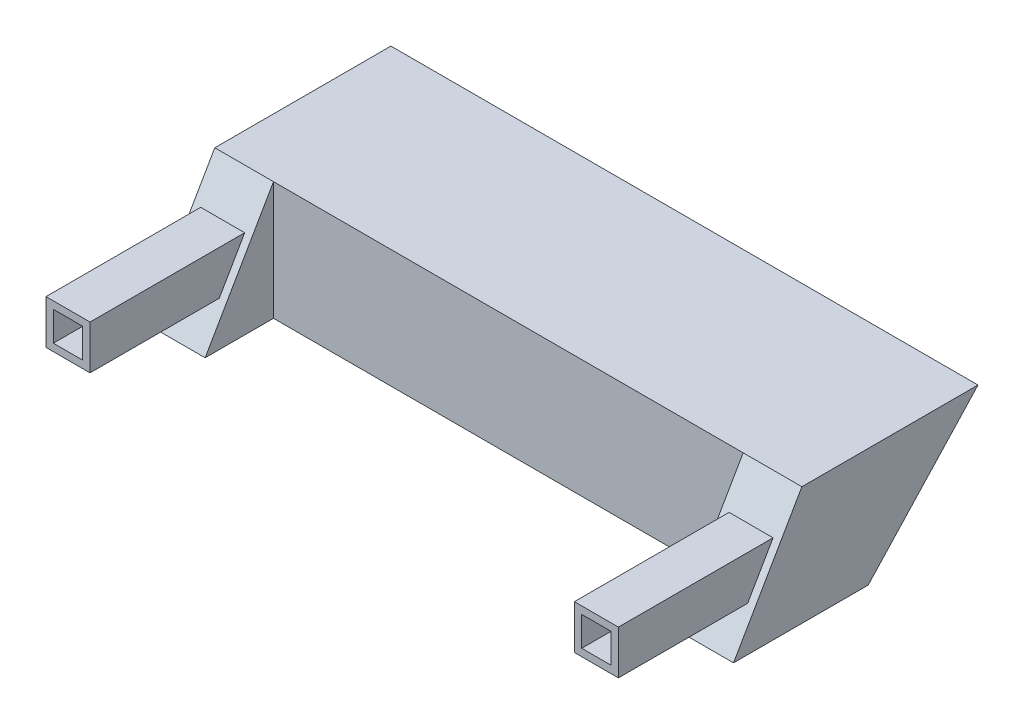
from build123d import *

# Parameters (mm, degrees)
BOSS_EXTRUDE1_DEPTH = 127
BOSS_EXTRUDE2_START = 101.6
BOSS_EXTRUDE2_DEPTH = 25.4
SKETCH4_W           = 19.05
SKETCH4_H           = 19.05
SKETCH4_W_2         = 12.7
SKETCH4_H_2         = 12.7
BOSS_EXTRUDE3_DEPTH = 76.2


with BuildPart() as part:
    # Sketch1 → Boss-Extrude1 (new, symmetric)
    with BuildSketch(Plane(origin=(0, 0, 0), x_dir=(0, 0, -1), z_dir=(1, 0, 0))):
        Polygon((0, 0), (0, 51.214865967), (76.2, 51.214865967), (28.702, 0), align=None)
    extrude(amount=BOSS_EXTRUDE1_DEPTH, both=True)

    # Sketch3 → Boss-Extrude2 (add)
    with BuildSketch(Plane(origin=(0, 0, 0), x_dir=(0, 0, -1), z_dir=(1, 0, 0)).offset(BOSS_EXTRUDE2_START)):
        Polygon((0, 51.214865967), (-29.568916652, 0), (0, 0), align=None)
    boss_extrude2 = extrude(amount=BOSS_EXTRUDE2_DEPTH)

    # Mirror1: Boss-Extrude2 across plane
    add(boss_extrude2.mirror(Plane(origin=(0, 0, 0), x_dir=(0, 0, 1), z_dir=(1, 0, 0))))

    # Sketch4 → Boss-Extrude3 (add)
    with BuildSketch(Plane.XY):
        with Locations((114.3, 25.607432983)):
            Rectangle(SKETCH4_W, SKETCH4_H)
        with Locations((114.3, 25.607432983)):
            Rectangle(SKETCH4_W_2, SKETCH4_H_2, mode=Mode.SUBTRACT)
    boss_extrude3 = extrude(amount=BOSS_EXTRUDE3_DEPTH)

    # Mirror2: Boss-Extrude3 across plane
    add(boss_extrude3.mirror(Plane(origin=(0, 0, 0), x_dir=(0, 0, 1), z_dir=(1, 0, 0))))


solid = part.part
